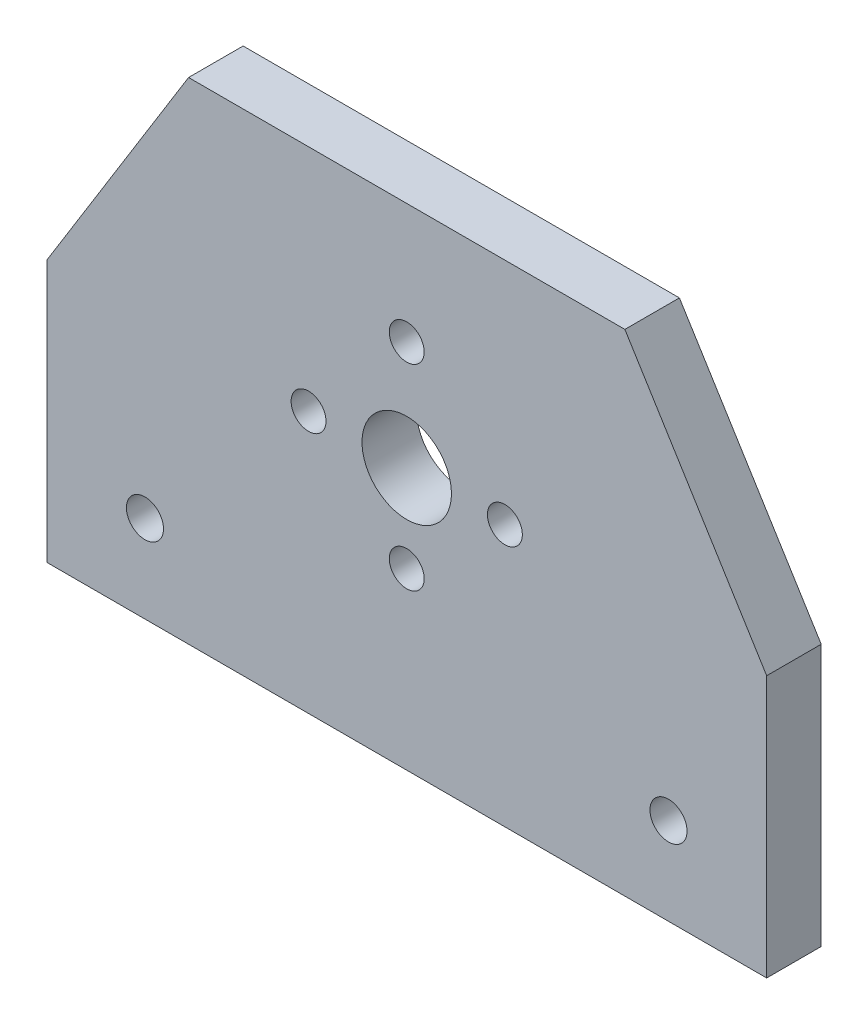
from build123d import *

# Parameters (mm, degrees)
SKETCH_1_R                 = 4.1
SKETCH_1_R_2               = 1.6
SKETCH_1_R_3               = 1.7
F_10_CAMERA_SIDE_EAR_DEPTH = 5


with BuildPart() as part:
    # Эскиз1 → 10_Camera_side_ear (new body)
    with BuildSketch(Plane.XY):
        Polygon((-33, 0), (33, 0), (33, 24), (20, 45), (-20, 45), (-33, 24), align=None)
        with Locations((0, 24)):
            Circle(SKETCH_1_R, mode=Mode.SUBTRACT)
        with Locations((-9, 24)):
            Circle(SKETCH_1_R_2, mode=Mode.SUBTRACT)
        with Locations((9, 24)):
            Circle(SKETCH_1_R_2, mode=Mode.SUBTRACT)
        with Locations((0, 16)):
            Circle(SKETCH_1_R_2, mode=Mode.SUBTRACT)
        with Locations((0, 34)):
            Circle(SKETCH_1_R_2, mode=Mode.SUBTRACT)
        with Locations((-24, 8)):
            Circle(SKETCH_1_R_3, mode=Mode.SUBTRACT)
        with Locations((24, 8)):
            Circle(SKETCH_1_R_3, mode=Mode.SUBTRACT)
    extrude(amount=F_10_CAMERA_SIDE_EAR_DEPTH)


solid = part.part
